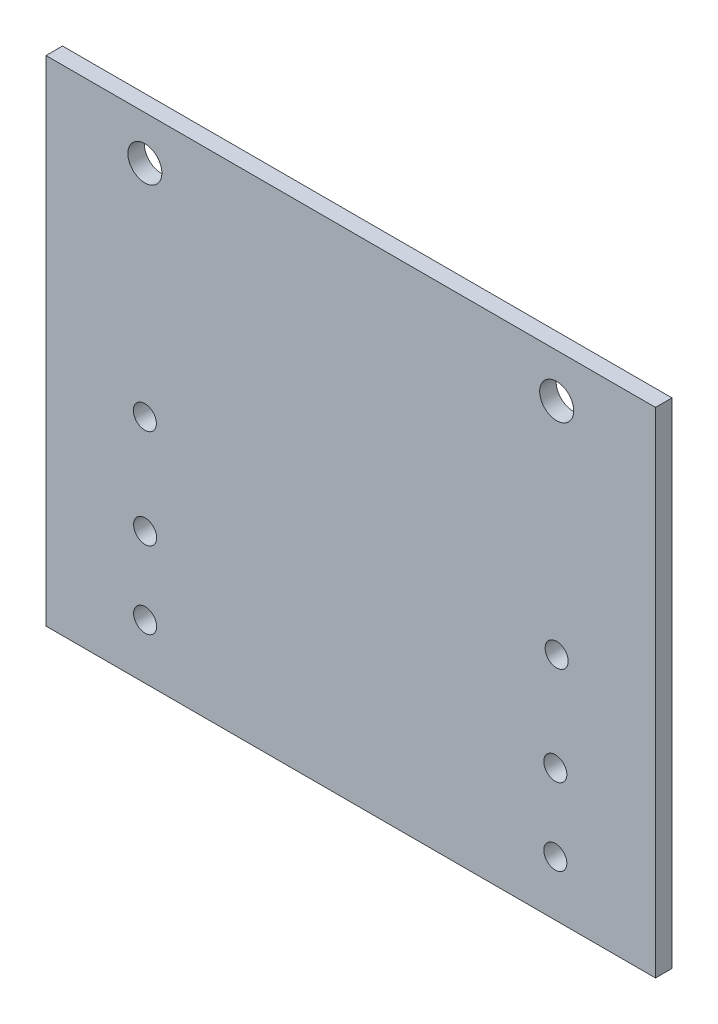
from build123d import *

# Parameters (mm, degrees)
SZKIC1_W                    = 111
SZKIC1_H                    = 90
DODANIE_WYCI_GNI_CIE1_DEPTH = 3
SZKIC2_R                    = 2.1
WYTNIJ_WYCI_GNI_CIE2_DEPTH  = 143.933550995
SZKIC3_R                    = 3.1
SZKIC3_R_2                  = 2.1
WYTNIJ_WYCI_GNI_CIE3_DEPTH  = 143.933550995


with BuildPart() as part:
    # Szkic1 → Dodanie-wyciągnięcie1 (new body)
    with BuildSketch(Plane.XY):
        with Locations((55.5, 45)):
            Rectangle(SZKIC1_W, SZKIC1_H)
    extrude(amount=DODANIE_WYCI_GNI_CIE1_DEPTH)

    # Szkic2 → Wytnij-wyciągnięcie2 (cut, through all)
    with BuildSketch(Plane.XY.offset(3)):
        with Locations((18.05, 24)):
            Circle(SZKIC2_R)
        with Locations((18.05, 10)):
            Circle(SZKIC2_R)
        with Locations((92.75, 24)):
            Circle(SZKIC2_R)
        with Locations((92.75, 10)):
            Circle(SZKIC2_R)
    extrude(amount=-WYTNIJ_WYCI_GNI_CIE2_DEPTH, mode=Mode.SUBTRACT)

    # Szkic3 → Wytnij-wyciągnięcie3 (cut, through all)
    with BuildSketch(Plane.XY.offset(3)):
        with Locations((93, 82)):
            Circle(SZKIC3_R)
        with Locations((93, 42)):
            Circle(SZKIC3_R_2)
        with Locations(Location((18, 42, 0), (0, 0, 180))):
            Circle(SZKIC3_R_2)
        with Locations(Location((18, 82, 0), (0, 0, 180))):
            Circle(SZKIC3_R)
    extrude(amount=-WYTNIJ_WYCI_GNI_CIE3_DEPTH, mode=Mode.SUBTRACT)


solid = part.part
